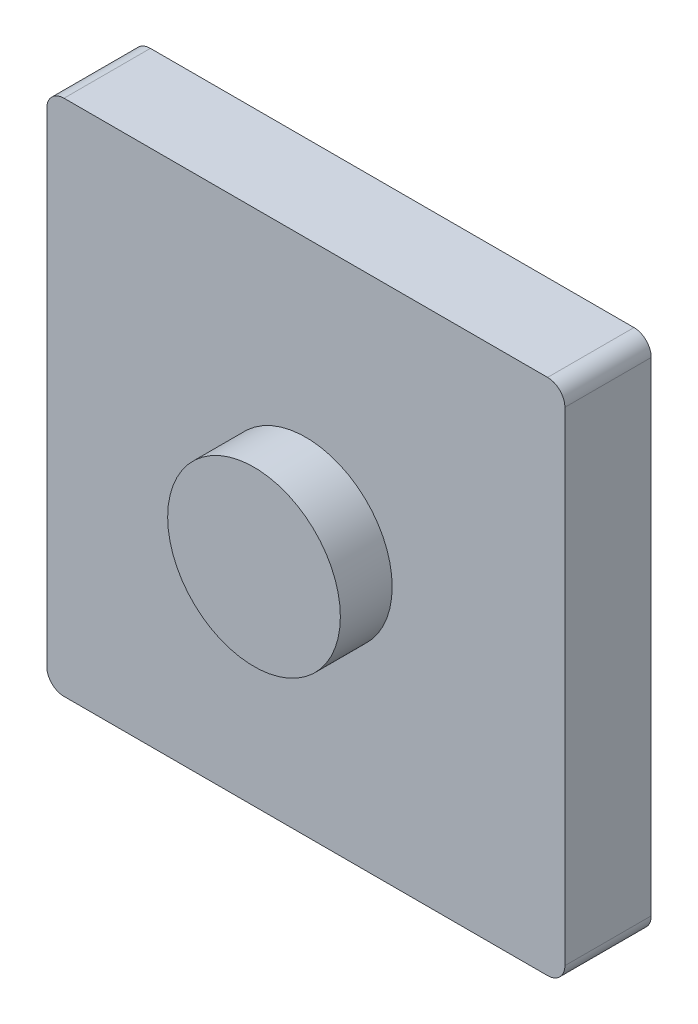
from build123d import *

# Parameters (mm, degrees)
BOSS_EXTRUDE1_DEPTH = 5
SKETCH2_R           = 5
BOSS_EXTRUDE2_DEPTH = 3


with BuildPart() as part:
    # Sketch1 → Boss-Extrude1 (new body)
    with BuildSketch(Plane.XY):
        with BuildLine():
            Line((1, 0), (29, 0))
            ThreePointArc((29, 0), (29.707106781, 0.292893219), (30, 1))
            Line((30, 1), (30, 29))
            ThreePointArc((30, 29), (29.707106781, 29.707106781), (29, 30))
            Line((29, 30), (1, 30))
            ThreePointArc((1, 30), (0.292893219, 29.707106781), (0, 29))
            Line((0, 29), (0, 1))
            ThreePointArc((0, 1), (0.292893219, 0.292893219), (1, 0))
        make_face()
    extrude(amount=BOSS_EXTRUDE1_DEPTH)

    # Sketch2 → Boss-Extrude2 (add)
    with BuildSketch(Plane.XY.offset(5)):
        with Locations(Location((15, 15, 0), (0, 0, 180))):
            Circle(SKETCH2_R)
    extrude(amount=BOSS_EXTRUDE2_DEPTH)


solid = part.part
